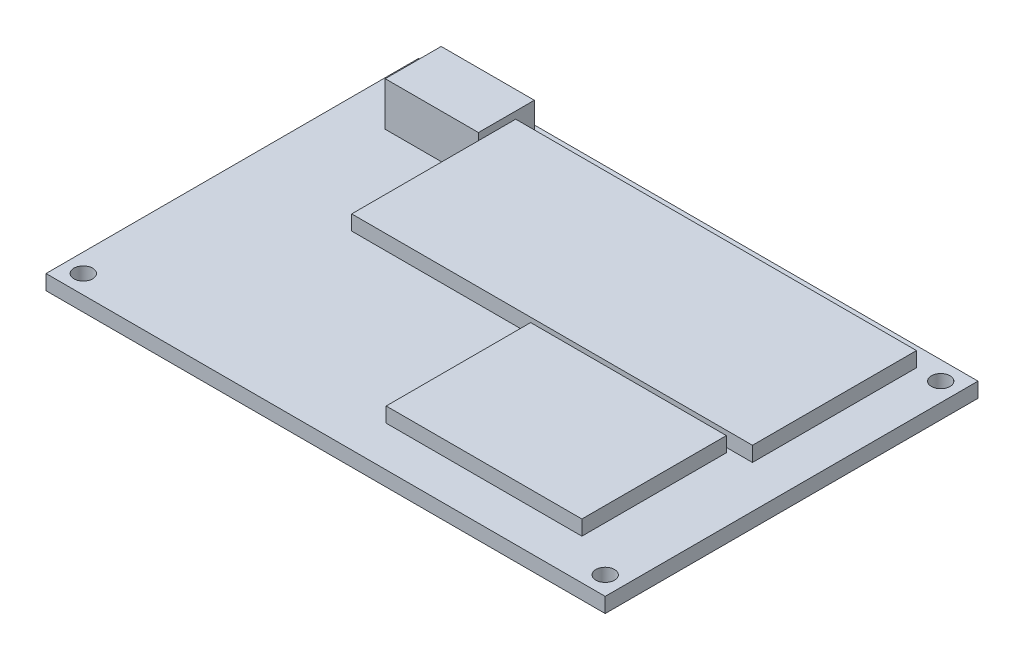
from build123d import *

# Parameters (mm, degrees)
SKETCH1_W             = 60
SKETCH1_H             = 40
SKETCH1_R             = 1
BOSS_EXTRUDE1_DEPTH   = 1.6
SKETCH3_W             = 43
SKETCH3_H             = 17.6
BOSS_EXTRUDE2_DEPTH   = 1.6
SKETCH3_W_2           = 21
SKETCH3_H_2           = 15.5
BOSS_EXTRUDE2_2_DEPTH = 1.6
SKETCH4_W             = 10
SKETCH4_H             = 6
BOSS_EXTRUDE3_DEPTH   = 4.7


with BuildPart() as part:
    # Sketch1 → Boss-Extrude1 (new body)
    with BuildSketch(Plane(origin=(0, 0, 0), x_dir=(1, 0, 0), z_dir=(0, 1, 0))):
        Rectangle(SKETCH1_W, SKETCH1_H)
        with Locations(Location((-28, 18, 0), (0, 0, 270))):
            Circle(SKETCH1_R, mode=Mode.SUBTRACT)
        with Locations(Location((28, 18, 0), (0, 0, 90))):
            Circle(SKETCH1_R, mode=Mode.SUBTRACT)
        with Locations(Location((28, -18, 0), (0, 0, 270))):
            Circle(SKETCH1_R, mode=Mode.SUBTRACT)
        with Locations(Location((-28, -18, 0), (0, 0, 90))):
            Circle(SKETCH1_R, mode=Mode.SUBTRACT)
    extrude(amount=BOSS_EXTRUDE1_DEPTH)

    # Sketch4 → Boss-Extrude3 (add)
    with BuildSketch(Plane(origin=(0, 1.6, 0), x_dir=(1, 0, 0), z_dir=(0, 1, 0))):
        with Locations((-20.2, 14.6)):
            Rectangle(SKETCH4_W, SKETCH4_H)
    extrude(amount=BOSS_EXTRUDE3_DEPTH)


with BuildPart() as body_2:
    # Sketch3 → Boss-Extrude2 (new body)
    with BuildSketch(Plane(origin=(0, 4.14, 0), x_dir=(1, 0, 0), z_dir=(0, 1, 0))):
        with Locations((6.5, 6.6)):
            Rectangle(SKETCH3_W, SKETCH3_H)
    extrude(amount=BOSS_EXTRUDE2_DEPTH)


with BuildPart() as body_3:
    # Sketch3 → Boss-Extrude2 2 (new body)
    with BuildSketch(Plane(origin=(0, 4.14, 0), x_dir=(1, 0, 0), z_dir=(0, 1, 0))):
        with Locations((15.2, -10.45)):
            Rectangle(SKETCH3_W_2, SKETCH3_H_2)
    extrude(amount=BOSS_EXTRUDE2_2_DEPTH)


solid = Compound([part.part, body_2.part, body_3.part])
